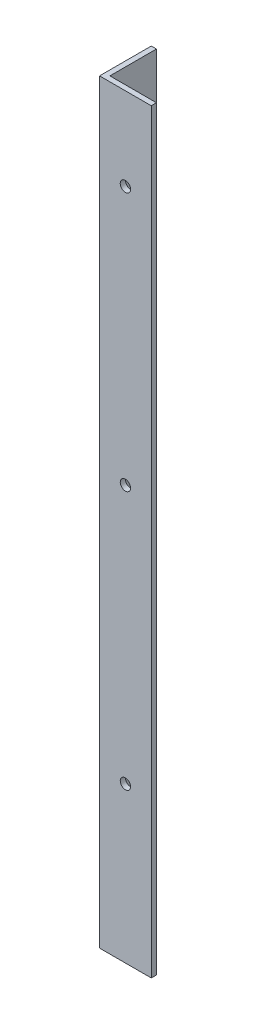
from build123d import *

# Parameters (mm, degrees)
BOSS_EXTRUDE1_DEPTH      = 146
BOSS_EXTRUDE1_DEPTH_BACK = 146
SKETCH2_R                = 2
CUT_EXTRUDE1_DEPTH       = 10
SKETCH3_R                = 2
CUT_EXTRUDE2_DEPTH       = 10


with BuildPart() as part:
    # Sketch1 → Boss-Extrude1 (new, two sides: drawn at the far end of the back side and taken through both)
    with BuildSketch(Plane(origin=(0, 0, 0), x_dir=(1, 0, 0), z_dir=(0, 1, 0)).offset(-BOSS_EXTRUDE1_DEPTH_BACK)):
        Polygon((0, 0), (20, 0), (20, 2), (2, 2), (2, 20), (0, 20), align=None)
    extrude(amount=BOSS_EXTRUDE1_DEPTH + BOSS_EXTRUDE1_DEPTH_BACK)

    # Sketch2 → Cut-Extrude1 (cut)
    with BuildSketch(Plane.XY):
        with Locations((10, 114)):
            Circle(SKETCH2_R)
        with Locations((10, 14)):
            Circle(SKETCH2_R)
        with Locations((10, -86)):
            Circle(SKETCH2_R)
    extrude(amount=-CUT_EXTRUDE1_DEPTH, mode=Mode.SUBTRACT)

    # Sketch3 → Cut-Extrude2 (cut)
    with BuildSketch(Plane.ZY):
        with Locations((-8, -114)):
            Circle(SKETCH3_R)
        with Locations((-8, -14)):
            Circle(SKETCH3_R)
        with Locations((-8, 86)):
            Circle(SKETCH3_R)
    extrude(amount=-CUT_EXTRUDE2_DEPTH, mode=Mode.SUBTRACT)


solid = part.part
